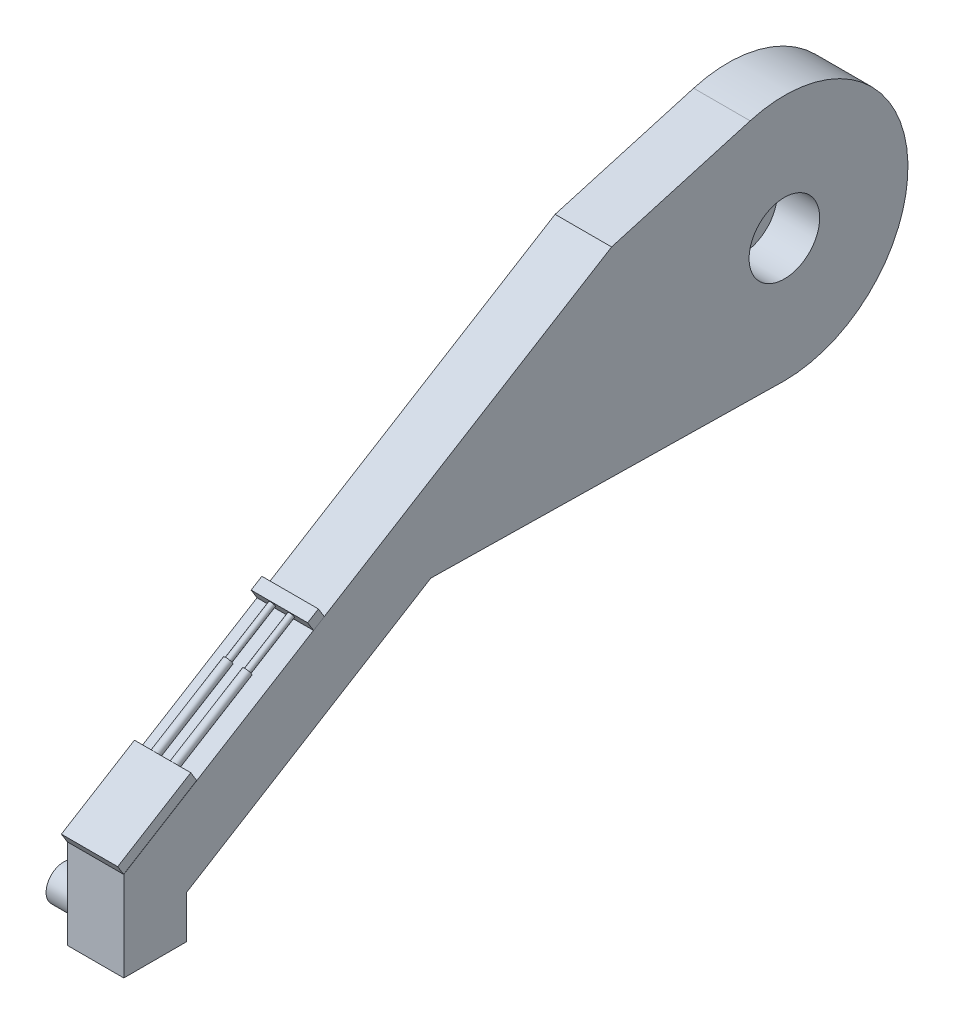
from build123d import *

# Parameters (mm, degrees)
BOSS_EXTRUDE1_DEPTH = 80
SKETCH2_R           = 50
CUT_EXTRUDE1_DEPTH  = 60
SKETCH3_R           = 25
BOSS_EXTRUDE2_DEPTH = 50
SKETCH4_W           = 79.742563162
SKETCH4_H           = 121.394874173
SKETCH4_W_2         = 80.091391525
SKETCH4_H_2         = 17.848004333
BOSS_EXTRUDE3_DEPTH = 16
SKETCH5_R           = 4.240124883
BOSS_EXTRUDE4_DEPTH = 73
SKETCH6_R           = 6
BOSS_EXTRUDE5_DEPTH = 130


with BuildPart() as part:
    # Sketch1 → Boss-Extrude1 (new body)
    with BuildSketch(Plane(origin=(0, 0, 0), x_dir=(0, 0, -1), z_dir=(1, 0, 0))):
        with BuildLine():
            Line((331.735644451, 300.452842372), (135.556846967, 243.860961507))
            Line((135.556846967, 243.860961507), (-555.240216811, -180.334724))
            Line((-555.240216811, -180.334724), (-555.240216811, -307.30913461))
            Line((-555.240216811, -307.30913461), (-466.406773101, -307.30913461))
            Line((-466.406773101, -307.30913461), (-466.406773101, -246.770086346))
            Line((-466.406773101, -246.770086346), (-120.382687357, -34.288111609))
            Line((-120.382687357, -34.288111609), (380.240216811, -42.69086539))
            ThreePointArc((380.240216811, -42.69086539), (553.517666092, 156.80251271), (331.735644451, 300.452842372))
        make_face()
    extrude(amount=BOSS_EXTRUDE1_DEPTH)

    # Sketch2 → Cut-Extrude1 (cut)
    with BuildSketch(Plane(origin=(80, 0, 0), x_dir=(0, 0, -1), z_dir=(1, 0, 0))):
        with Locations((380.240216811, 132.30913461)):
            Circle(SKETCH2_R)
    extrude(amount=-CUT_EXTRUDE1_DEPTH, mode=Mode.SUBTRACT)

    # Sketch3 → Boss-Extrude2 (add)
    with BuildSketch(Plane.ZY):
        with Locations(Location((510.240216811, -277.30913461, 0), (0, 0, 180))):
            Circle(SKETCH3_R)
    extrude(amount=BOSS_EXTRUDE2_DEPTH)

    # Sketch4 → Boss-Extrude3 (add)
    with BuildSketch(Plane(origin=(0, 116.638229969, 71.623688797), x_dir=(1, 0, 0), z_dir=(0, 0.8521590965506678, 0.5232827860401582))):
        with Locations((39.871281581, -506.821621235)):
            Rectangle(SKETCH4_W, SKETCH4_H)
        with Locations((40.045695763, -243.31556705)):
            Rectangle(SKETCH4_W_2, SKETCH4_H_2)
    extrude(amount=BOSS_EXTRUDE3_DEPTH)

    # Sketch5 → Boss-Extrude4 (add)
    with BuildSketch(Plane(origin=(0, -131.992624529, 214.948243417), x_dir=(1, 0, 0), z_dir=(0, -0.5232827860401582, 0.8521590965506678))):
        with Locations(Location((26.380961451, 146.454280366, 0), (0, 0, 90))):
            Circle(SKETCH5_R)
        with Locations(Location((53.361601711, 146.454280366, 0), (0, 0, 90))):
            Circle(SKETCH5_R)
    extrude(amount=BOSS_EXTRUDE4_DEPTH)

    # Sketch6 → Boss-Extrude5 (add)
    with BuildSketch(Plane(origin=(0, -170.19226791, 277.155857465), x_dir=(1, 0, 0), z_dir=(0, -0.5232827860401582, 0.8521590965506676))):
        with Locations(Location((26.380961451, 146.454280366, 0), (0, 0, 270))):
            Circle(SKETCH6_R)
        with Locations(Location((53.361601711, 146.454280366, 0), (0, 0, 270))):
            Circle(SKETCH6_R)
    extrude(amount=BOSS_EXTRUDE5_DEPTH)


solid = part.part
